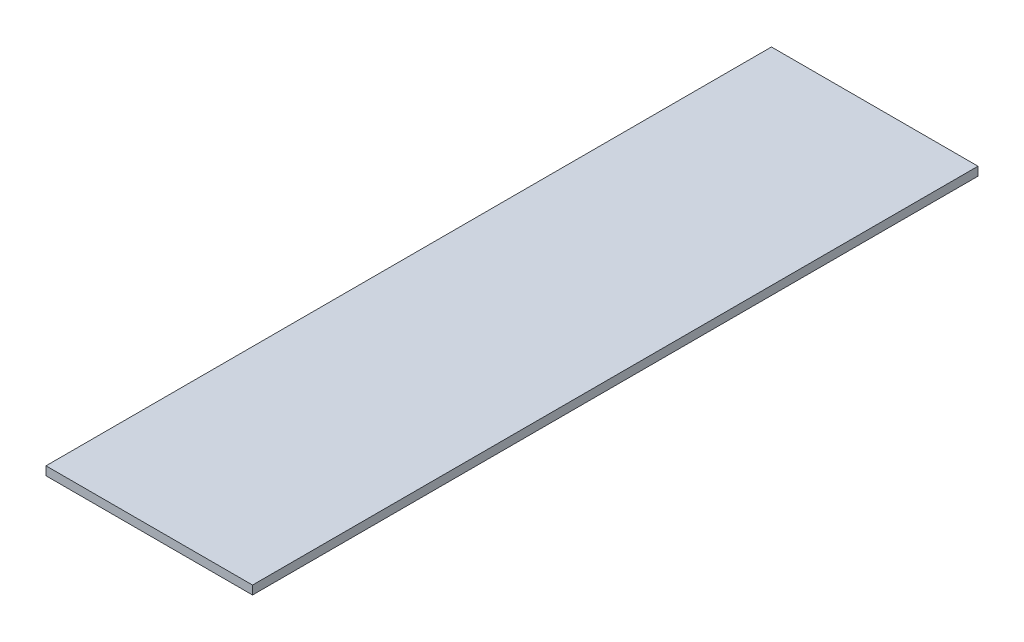
from build123d import *

# Parameters (mm, degrees)
SKETCH_1_W      = 715
SKETCH_1_H      = 2511.5
EXTRUDE_1_DEPTH = 30


with BuildPart() as part:
    # Эскиз1 → Бобышка-Вытянуть1 (new body)
    with BuildSketch(Plane(origin=(0, 0, 0), x_dir=(1, 0, 0), z_dir=(0, 1, 0))):
        Rectangle(SKETCH_1_W, SKETCH_1_H)
    extrude(amount=EXTRUDE_1_DEPTH)


solid = part.part
